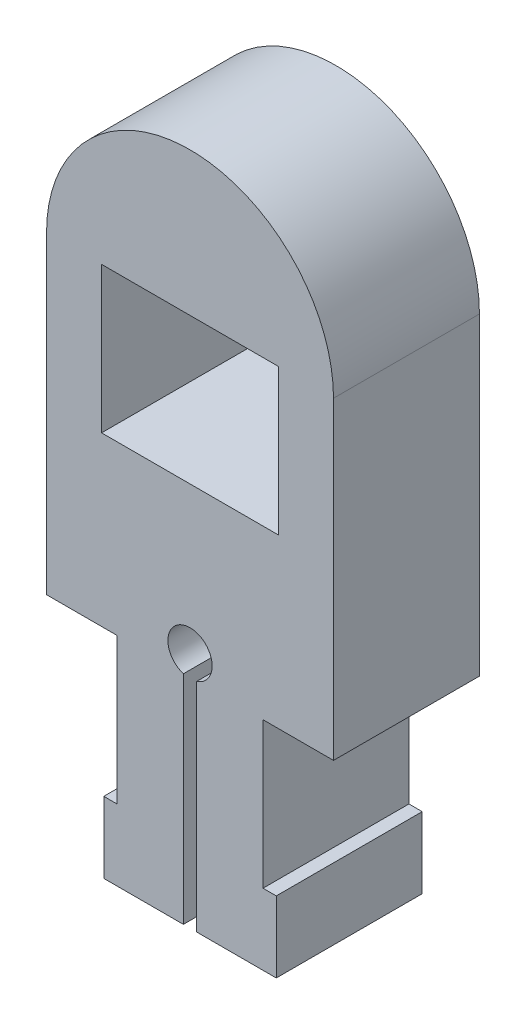
from build123d import *

# Parameters (mm, degrees)
SALIENTE_EXTRUIR2_DEPTH = 3.3


with BuildPart() as part:
    # Croquis2 → Saliente-Extruir2 (new body)
    with BuildSketch(Plane.XY):
        with BuildLine():
            Line((-0.15, -3.776969601), (-0.15, -0.476969601))
            ThreePointArc((-0.15, -0.476969601), (0, 0.5), (0.15, -0.476969601))
            Line((0.15, -0.476969601), (0.15, -3.776969601))
            Line((0.15, -3.776969601), (0.15, -5.384848335))
            Line((0.15, -5.384848335), (1.95, -5.384848335))
            Line((1.95, -5.384848335), (1.95, -3.776969601))
            Line((1.95, -3.776969601), (1.65, -3.776969601))
            Line((1.65, -3.776969601), (1.65, -0.476969601))
            Line((1.65, -0.476969601), (3.24401575, -0.476969601))
            Line((3.24401575, -0.476969601), (3.24401575, 1.350254565))
            Line((3.24401575, 1.350254565), (3.24401575, 6.615151665))
            ThreePointArc((3.24401575, 6.615151665), (0, 9.859167415), (-3.24401575, 6.615151665))
            Line((-3.24401575, 6.615151665), (-3.24401575, 1.350254565))
            Line((-3.24401575, 1.350254565), (-3.24401575, -0.476969601))
            Line((-3.24401575, -0.476969601), (-1.65, -0.476969601))
            Line((-1.65, -0.476969601), (-1.65, -3.776969601))
            Line((-1.65, -3.776969601), (-1.95, -3.776969601))
            Line((-1.95, -3.776969601), (-1.95, -5.384848335))
            Line((-1.95, -5.384848335), (-0.15, -5.384848335))
            Line((-0.15, -5.384848335), (-0.15, -3.776969601))
        make_face()
        Polygon((-2, 6.615151665), (0, 6.615151665), (2, 6.615151665), (2, 3.315151665), (-2, 3.315151665), align=None, mode=Mode.SUBTRACT)
    extrude(amount=SALIENTE_EXTRUIR2_DEPTH)


solid = part.part
